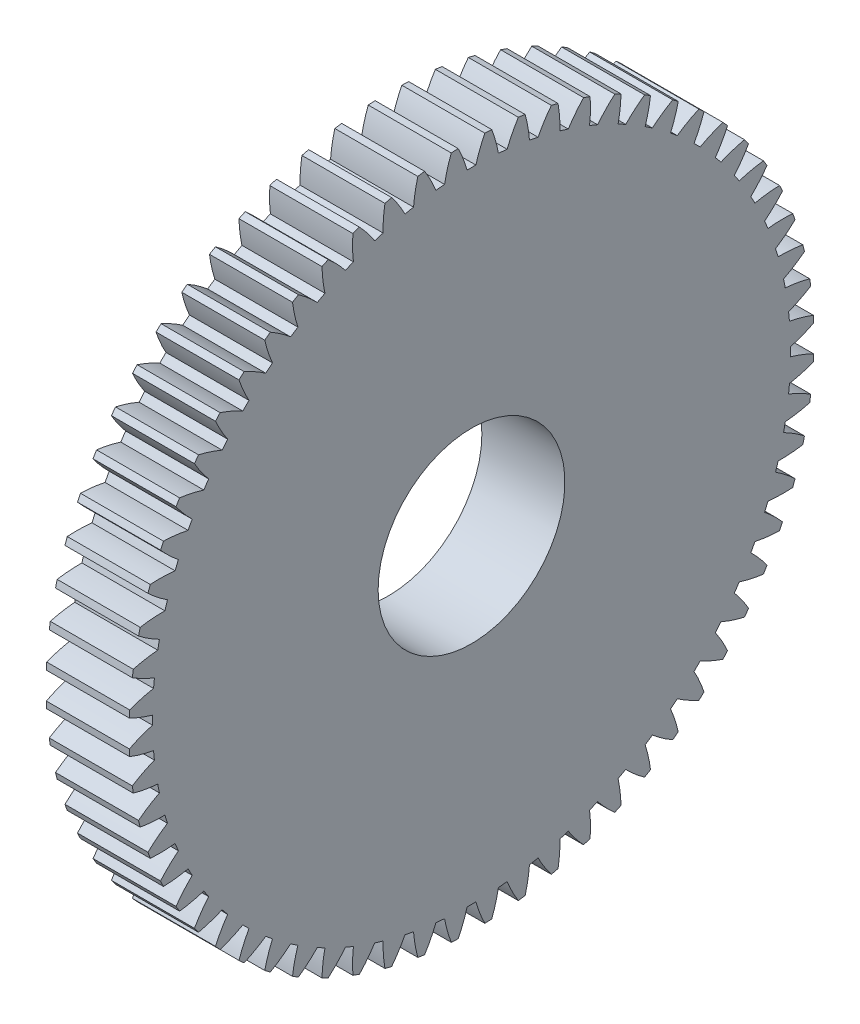
from build123d import *

# Parameters (mm, degrees)
BASPROSKE_W     = 40
BASPROSKE_H     = 165
TOOTHCUT_DEPTH  = 237.748812035
TEETHCUTS_COUNT = 64
BORSKE_R        = 45
BORE_DEPTH      = 50.0000508


with BuildPart() as part:
    # BasProSke → Base-Revolve (revolve)
    with BuildSketch(Plane(origin=(0, 0, 0), x_dir=(1, 0, 0), z_dir=(0, 1, 0)), mode=Mode.PRIVATE) as base_revolve_sk:
        with Locations((20, 82.5)):
            Rectangle(BASPROSKE_W, BASPROSKE_H)
    revolve(base_revolve_sk.sketch.rotate(Axis((-10, 0, 0), (1, 0, 0)), 180), axis=Axis((-10, 0, 0), (1, 0, 0)))

    # TooCutSke → ToothCut (cut, through all)
    with BuildSketch(Plane(origin=(0, 0, 0), x_dir=(0, 0, -1), z_dir=(1, 0, 0))):
        with BuildLine():
            ThreePointArc((2.101326471, 153.734639649), (0, 153.749), (-2.101326471, 153.734639649))
            ThreePointArc((-2.101326471, 153.734639649), (-4.011704341, 159.418933084), (-6.445723142, 164.899470279))
            ThreePointArc((-6.445723142, 164.899470279), (0, 165.0254), (6.445723142, 164.899470279))
            ThreePointArc((6.445723142, 164.899470279), (4.011704341, 159.418933084), (2.101326471, 153.734639649))
        make_face()
    toothcut = extrude(amount=TOOTHCUT_DEPTH, mode=Mode.SUBTRACT)

    # TeethCuts: ToothCut ×64 about axis
    teethcuts_axis = Axis((0, 0, 0), (1, 0, 0))
    for i in range(1, TEETHCUTS_COUNT):
        add(toothcut.rotate(teethcuts_axis, i * 360 / TEETHCUTS_COUNT), mode=Mode.SUBTRACT)

    # BorSke → Bore (cut, symmetric)
    with BuildSketch(Plane(origin=(0, 0, 0), x_dir=(0, 0, -1), z_dir=(1, 0, 0))):
        with Locations(Location((0, 0, 0), (0, 0, 180))):
            Circle(BORSKE_R)
    extrude(amount=BORE_DEPTH, both=True, mode=Mode.SUBTRACT)


solid = part.part
